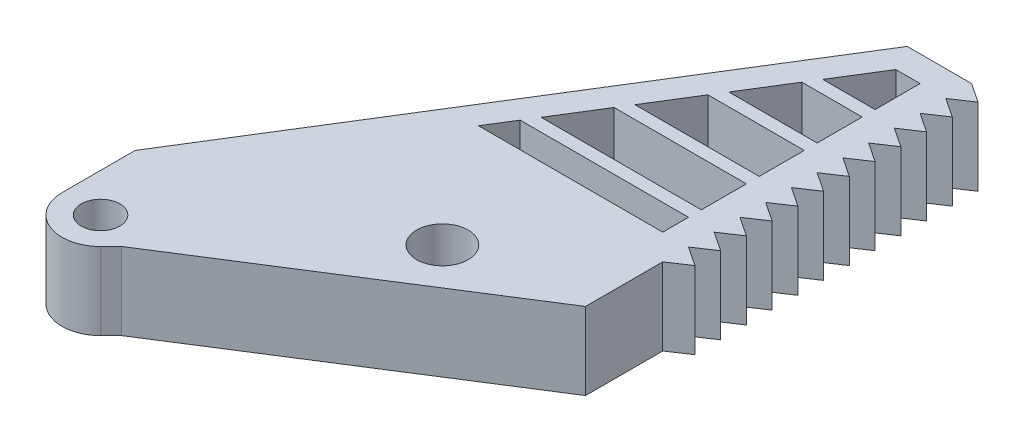
from build123d import *

# Parameters (mm, degrees)
EXTRUDE_1_DEPTH        = 6
CUT_EXTRUDE_1_DEPTH    = 58.619441164
SKETCH_3_W             = 4.685619361
SKETCH_3_H             = 1
SKETCH_3_W_2           = 7.482916658
SKETCH_3_W_3           = 10.280213956
SKETCH_3_W_4           = 13.077511253
EXTRUDE_1_2_DEPTH      = 6
EXTRUDE_2_DEPTH        = 6
PATTERN_LINEAR_1_COUNT = 12
PATTERN_LINEAR_1_PITCH = 2
FILLET_3_R             = 3
SKETCH_5_R             = 1.5
SKETCH_5_R_2           = 2
CUT_EXTRUDE_2_DEPTH    = 54.92122199


with BuildPart() as part:
    # 草图1 → Extrude 1 (new body)
    with BuildSketch(Plane(origin=(0, 0, 0), x_dir=(1, 0, 0), z_dir=(0, 1, 0))):
        Polygon((0, 0), (-5, 0), (-28, -37), (-28, -50), (-22.078758581, -44), (0, -30), align=None)
    extrude(amount=EXTRUDE_1_DEPTH)

    # 草图2 → 切除-拉伸1 (cut, through all)
    with BuildSketch(Plane(origin=(0, 6, 0), x_dir=(1, 0, 0), z_dir=(0, 1, 0))):
        Polygon((-3.888322064, -2), (-2, -2), (-2, -22), (-16.320754496, -22), align=None)
    extrude(amount=-CUT_EXTRUDE_1_DEPTH, mode=Mode.SUBTRACT)

    # 草图3 → Extrude 1 2 (add)
    with BuildSketch(Plane(origin=(0, 6, 0), x_dir=(1, 0, 0), z_dir=(0, 1, 0))):
        with Locations((-4.342809681, -6)):
            Rectangle(SKETCH_3_W, SKETCH_3_H)
        with Locations((-5.741458329, -10.5)):
            Rectangle(SKETCH_3_W_2, SKETCH_3_H)
        with Locations((-7.140106978, -15)):
            Rectangle(SKETCH_3_W_3, SKETCH_3_H)
        with Locations((-8.538755627, -19.5)):
            Rectangle(SKETCH_3_W_4, SKETCH_3_H)
    extrude(amount=-EXTRUDE_1_2_DEPTH)

    # 草图4 → 凸台-拉伸2 (add)
    with BuildSketch(Plane(origin=(0, 6, 0), x_dir=(1, 0, 0), z_dir=(0, 1, 0))):
        Polygon((0, 0), (1.5, -1), (0, -2), align=None)
    extrude_2 = extrude(amount=-EXTRUDE_2_DEPTH)

    # 阵列(线性)1: 凸台-拉伸2 ×12
    with Locations(*[(0, 0, i * PATTERN_LINEAR_1_PITCH) for i in range(1, PATTERN_LINEAR_1_COUNT)]):
        add(extrude_2)

    # 圆角3
    fillet_3_edges = [part.edges().sort_by_distance(p)[0] for p in [
        (-28, 3, 50),
    ]]
    fillet(fillet_3_edges, radius=FILLET_3_R)

    # 草图5 → 切除-拉伸2 (cut, through all)
    with BuildSketch(Plane(origin=(0, 6, 0), x_dir=(1, 0, 0), z_dir=(0, 1, 0))):
        with Locations(Location((-25, -42.689147299, 0), (0, 0, 270))):
            Circle(SKETCH_5_R)
        with Locations(Location((-9.704707061, -31.417323404, 0), (0, 0, 270))):
            Circle(SKETCH_5_R_2)
    extrude(amount=-CUT_EXTRUDE_2_DEPTH, mode=Mode.SUBTRACT)


solid = part.part
